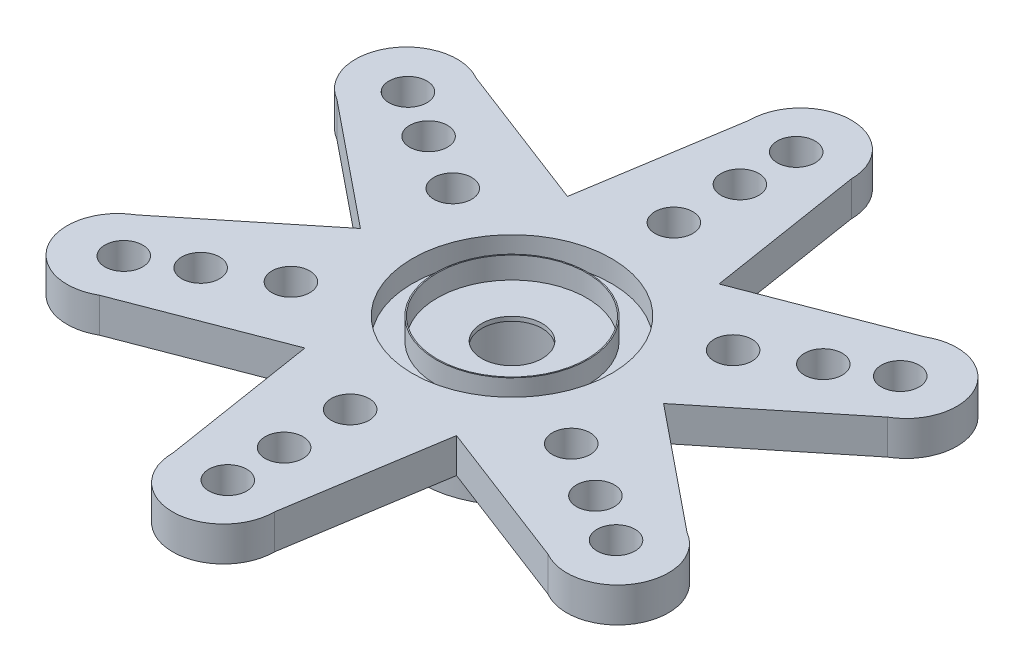
from build123d import *

# Parameters (mm, degrees)
SALIENTE_EXTRUIR1_DEPTH = 1.6
CROQUIS3_R              = 4.2
SALIENTE_EXTRUIR2_DEPTH = 3
CROQUIS4_R              = 4.6
CORTAR_EXTRUIR1_DEPTH   = 1
CROQUIS5_R              = 3.5
CROQUIS5_R_2            = 3.45
SALIENTE_EXTRUIR3_DEPTH = 1
CROQUIS6_R              = 0.875
CORTAR_EXTRUIR2_DEPTH   = 22.438435028
CROQUIS7_R              = 1.4
CORTAR_EXTRUIR3_DEPTH   = 22.246329011
CROQUIS8_R              = 2.65
CORTAR_EXTRUIR4_DEPTH   = 3.4


with BuildPart() as part:
    # Croquis1 → Saliente-Extruir1 (new body)
    with BuildSketch(Plane(origin=(0, 0, 0), x_dir=(1, 0, 0), z_dir=(0, 1, 0))):
        with BuildLine():
            ThreePointArc((2.35, 13.321654392), (0, 15.671654392), (-2.35, 13.321654392))
            Line((-2.35, 13.321654392), (-3.5, 6.062177826))
            Line((-3.5, 6.062177826), (-10.361891124, 8.695986895))
            ThreePointArc((-10.361891124, 8.695986895), (-13.572050822, 7.835827196), (-12.711891124, 4.625667497))
            Line((-12.711891124, 4.625667497), (-7, 0))
            Line((-7, 0), (-12.711891124, -4.625667497))
            ThreePointArc((-12.711891124, -4.625667497), (-13.572050822, -7.835827196), (-10.361891124, -8.695986895))
            Line((-10.361891124, -8.695986895), (-3.5, -6.062177826))
            Line((-3.5, -6.062177826), (-2.35, -13.321654392))
            ThreePointArc((-2.35, -13.321654392), (0, -15.671654392), (2.35, -13.321654392))
            Line((2.35, -13.321654392), (3.5, -6.062177826))
            Line((3.5, -6.062177826), (10.361891124, -8.695986895))
            ThreePointArc((10.361891124, -8.695986895), (13.572050822, -7.835827196), (12.711891124, -4.625667497))
            Line((12.711891124, -4.625667497), (7, 0))
            Line((7, 0), (12.711891124, 4.625667497))
            ThreePointArc((12.711891124, 4.625667497), (13.572050822, 7.835827196), (10.361891124, 8.695986895))
            Line((10.361891124, 8.695986895), (3.5, 6.062177826))
            Line((3.5, 6.062177826), (2.35, 13.321654392))
        make_face()
    extrude(amount=SALIENTE_EXTRUIR1_DEPTH)

    # Croquis3 → Saliente-Extruir2 (add)
    with BuildSketch(Plane.XZ):
        with Locations(Location((0, 0, 0), (0, 0, 90))):
            Circle(CROQUIS3_R)
    extrude(amount=SALIENTE_EXTRUIR2_DEPTH)

    # Croquis4 → Cortar-Extruir1 (cut)
    with BuildSketch(Plane(origin=(0, 1.6, 0), x_dir=(1, 0, 0), z_dir=(0, 1, 0))):
        with Locations(Location((0, 0, 0), (0, 0, 270))):
            Circle(CROQUIS4_R)
    extrude(amount=-CORTAR_EXTRUIR1_DEPTH, mode=Mode.SUBTRACT)

    # Croquis5 → Saliente-Extruir3 (add)
    with BuildSketch(Plane(origin=(0, 0.6, 0), x_dir=(1, 0, 0), z_dir=(0, 1, 0))):
        with Locations(Location((0, 0, 0), (0, 0, 270))):
            Circle(CROQUIS5_R)
        with Locations(Location((0, 0, 0), (0, 0, 270))):
            Circle(CROQUIS5_R_2, mode=Mode.SUBTRACT)
    extrude(amount=SALIENTE_EXTRUIR3_DEPTH)

    # Croquis6 → Cortar-Extruir2 (cut, through all)
    with BuildSketch(Plane(origin=(0, 1.6, 0), x_dir=(1, 0, 0), z_dir=(0, 1, 0))):
        with Locations(Location((11.366583425, 6.5625, 0), (0, 0, 270))):
            Circle(CROQUIS6_R)
        with Locations(Location((9.114917375, 5.2625, 0), (0, 0, 270))):
            Circle(CROQUIS6_R)
        with Locations(Location((6.473539893, 3.7375, 0), (0, 0, 270))):
            Circle(CROQUIS6_R)
        with Locations(Location((11.366583425, -6.5625, 0), (0, 0, 270))):
            Circle(CROQUIS6_R)
        with Locations(Location((9.114917375, -5.2625, 0), (0, 0, 270))):
            Circle(CROQUIS6_R)
        with Locations(Location((6.473539893, -3.7375, 0), (0, 0, 270))):
            Circle(CROQUIS6_R)
        with Locations(Location((0, -13.125, 0), (0, 0, 270))):
            Circle(CROQUIS6_R)
        with Locations(Location((0, -10.525, 0), (0, 0, 270))):
            Circle(CROQUIS6_R)
        with Locations(Location((0, -7.475, 0), (0, 0, 270))):
            Circle(CROQUIS6_R)
        with Locations(Location((-11.366583425, -6.5625, 0), (0, 0, 270))):
            Circle(CROQUIS6_R)
        with Locations(Location((-9.114917375, -5.2625, 0), (0, 0, 270))):
            Circle(CROQUIS6_R)
        with Locations(Location((-6.473539893, -3.7375, 0), (0, 0, 270))):
            Circle(CROQUIS6_R)
        with Locations(Location((-11.366583425, 6.5625, 0), (0, 0, 270))):
            Circle(CROQUIS6_R)
        with Locations(Location((-9.114917375, 5.2625, 0), (0, 0, 270))):
            Circle(CROQUIS6_R)
        with Locations(Location((-6.473539893, 3.7375, 0), (0, 0, 270))):
            Circle(CROQUIS6_R)
        with Locations(Location((0, 13.125, 0), (0, 0, 270))):
            Circle(CROQUIS6_R)
        with Locations(Location((0, 10.525, 0), (0, 0, 270))):
            Circle(CROQUIS6_R)
        with Locations(Location((0, 7.475, 0), (0, 0, 270))):
            Circle(CROQUIS6_R)
    extrude(amount=-CORTAR_EXTRUIR2_DEPTH, mode=Mode.SUBTRACT)

    # Croquis7 → Cortar-Extruir3 (cut, through all)
    with BuildSketch(Plane(origin=(0, 0.6, 0), x_dir=(1, 0, 0), z_dir=(0, 1, 0))):
        with Locations(Location((0, 0, 0), (0, 0, 270))):
            Circle(CROQUIS7_R)
    extrude(amount=-CORTAR_EXTRUIR3_DEPTH, mode=Mode.SUBTRACT)

    # Croquis8 → Cortar-Extruir4 (cut)
    with BuildSketch(Plane.XZ.offset(3)):
        with Locations(Location((0, 0, 0), (0, 0, 270))):
            Circle(CROQUIS8_R)
    extrude(amount=-CORTAR_EXTRUIR4_DEPTH, mode=Mode.SUBTRACT)


solid = part.part
